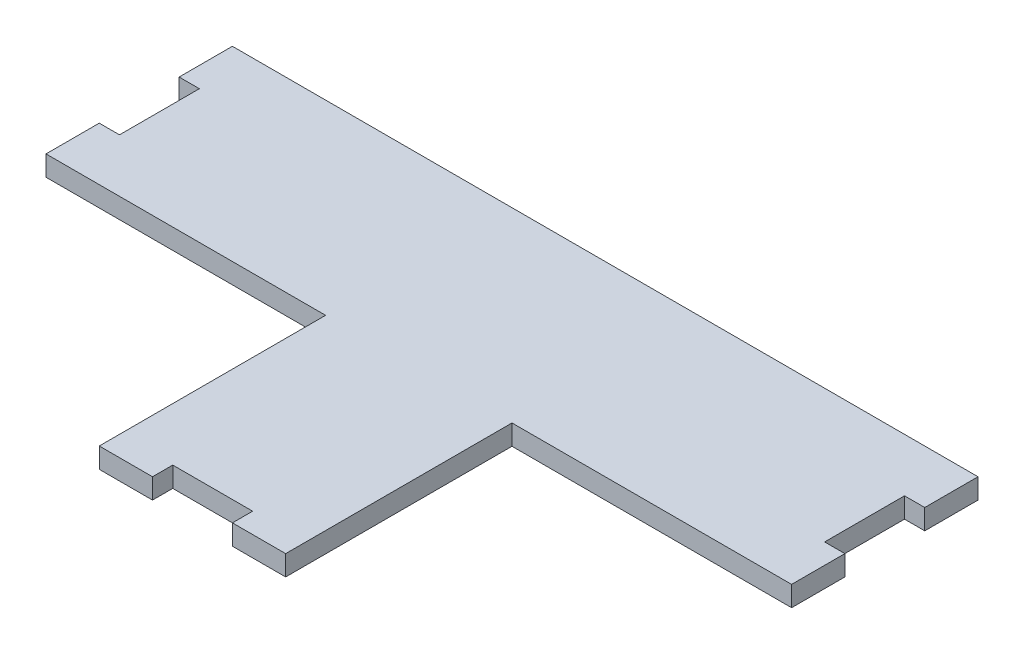
from build123d import *

# Parameters (mm, degrees)
SKETCH1_W           = 177.8
SKETCH1_H           = 98.425
BOSS_EXTRUDE1_DEPTH = 4.826
SKETCH2_W           = 4.826
SKETCH2_H           = 19.05
SKETCH2_W_2         = 19.05
SKETCH2_H_2         = 4.826
ALL_SLOTS_DEPTH     = 204.282096853
SKETCH3_W           = 66.675
SKETCH3_H           = 53.975
CUT_EXTRUDE2_DEPTH  = 204.282096853


with BuildPart() as part:
    # Sketch1 → Boss-Extrude1 (new body)
    with BuildSketch(Plane(origin=(0, 0, 0), x_dir=(1, 0, 0), z_dir=(0, 1, 0))):
        with Locations((88.9, 49.2125)):
            Rectangle(SKETCH1_W, SKETCH1_H)
    extrude(amount=BOSS_EXTRUDE1_DEPTH)

    # Sketch2 → All Slots (cut, through all)
    with BuildSketch(Plane(origin=(0, 4.826, 0), x_dir=(1, 0, 0), z_dir=(0, 1, 0))):
        with Locations((2.413, 76.2)):
            Rectangle(SKETCH2_W, SKETCH2_H)
        with Locations((175.387, 76.2)):
            Rectangle(SKETCH2_W, SKETCH2_H)
        with Locations((88.9, 2.413)):
            Rectangle(SKETCH2_W_2, SKETCH2_H_2)
    extrude(amount=-ALL_SLOTS_DEPTH, mode=Mode.SUBTRACT)

    # Sketch3 → Cut-Extrude2 (cut, through all)
    with BuildSketch(Plane(origin=(0, 4.826, 0), x_dir=(1, 0, 0), z_dir=(0, 1, 0))):
        with Locations((33.3375, 26.9875)):
            Rectangle(SKETCH3_W, SKETCH3_H)
        with Locations((144.4625, 26.9875)):
            Rectangle(SKETCH3_W, SKETCH3_H)
    extrude(amount=-CUT_EXTRUDE2_DEPTH, mode=Mode.SUBTRACT)


solid = part.part
